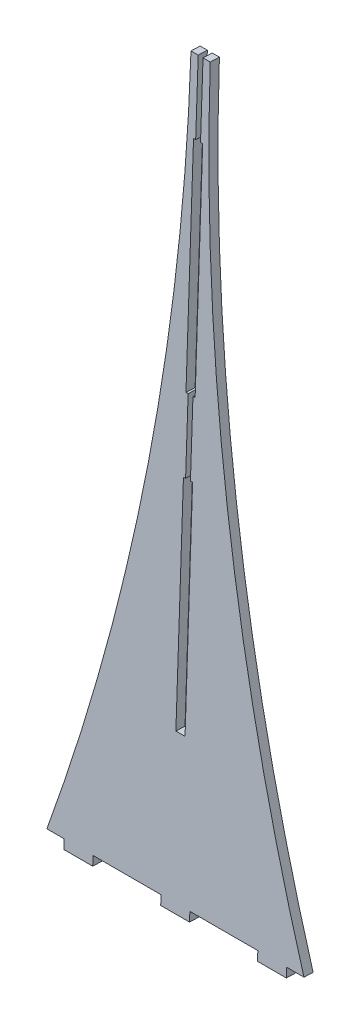
from build123d import *

# Parameters (mm, degrees)
SKETCH1_W           = 10
SKETCH1_H           = 3.175
SKETCH1_W_2         = 3.175
SKETCH1_H_2         = 50
BOSS_EXTRUDE1_DEPTH = 3.175


with BuildPart() as part:
    # Sketch1 → Boss-Extrude1 (new body)
    with BuildSketch(Plane(origin=(0, -2.422329102, -69.308356399), x_dir=(-1, 0, 0), z_dir=(0, -0.03492870325036369, -0.9993898066766782))):
        with BuildLine():
            Line((-5, 79.214647081), (-1.5875, 79.214647081))
            Line((-1.5875, 79.214647081), (-1.5875, 129.214647081))
            Line((-1.5875, 129.214647081), (-1.5875, 204.214647081))
            Line((-1.5875, 204.214647081), (-0.8375, 204.214647081))
            Line((-0.8375, 204.214647081), (-0.8375, 229.214647081))
            Line((-0.8375, 229.214647081), (-1.5875, 229.214647081))
            Line((-1.5875, 229.214647081), (-1.5875, 304.214647081))
            Line((-1.5875, 304.214647081), (-0.8375, 304.214647081))
            Line((-0.8375, 304.214647081), (-0.8375, 329.214647081))
            Line((-0.8375, 329.214647081), (-3.3375, 329.214647081))
            ThreePointArc((-3.3375, 329.214647081), (-13.715159098, 202.525816485), (-44.57145678, 79.214647081))
            Line((-44.57145678, 79.214647081), (-38.57145678, 79.214647081))
            Line((-38.57145678, 79.214647081), (-28.57145678, 79.214647081))
            Line((-28.57145678, 79.214647081), (-5, 79.214647081))
        make_face()
        with BuildLine():
            ThreePointArc((44.57145678, 79.214647081), (13.715159098, 202.525816485), (3.3375, 329.214647081))
            Line((3.3375, 329.214647081), (0.8375, 329.214647081))
            Line((0.8375, 329.214647081), (0.8375, 304.214647081))
            Line((0.8375, 304.214647081), (1.5875, 304.214647081))
            Line((1.5875, 304.214647081), (1.5875, 229.214647081))
            Line((1.5875, 229.214647081), (0.8375, 229.214647081))
            Line((0.8375, 229.214647081), (0.8375, 204.214647081))
            Line((0.8375, 204.214647081), (1.5875, 204.214647081))
            Line((1.5875, 204.214647081), (1.5875, 129.214647081))
            Line((1.5875, 129.214647081), (1.5875, 79.214647081))
            Line((1.5875, 79.214647081), (5, 79.214647081))
            Line((5, 79.214647081), (28.57145678, 79.214647081))
            Line((28.57145678, 79.214647081), (38.57145678, 79.214647081))
            Line((38.57145678, 79.214647081), (44.57145678, 79.214647081))
        make_face()
        Polygon((5, 76.039647081), (5, 79.214647081), (1.5875, 79.214647081), (-1.5875, 79.214647081), (-5, 79.214647081), (-5, 76.039647081), align=None)
        with Locations((33.57145678, 77.627147081)):
            Rectangle(SKETCH1_W, SKETCH1_H)
        with Locations((0, 104.214647081)):
            Rectangle(SKETCH1_W_2, SKETCH1_H_2)
        with Locations((-33.57145678, 77.627147081)):
            Rectangle(SKETCH1_W, SKETCH1_H)
    extrude(amount=BOSS_EXTRUDE1_DEPTH)


solid = part.part
